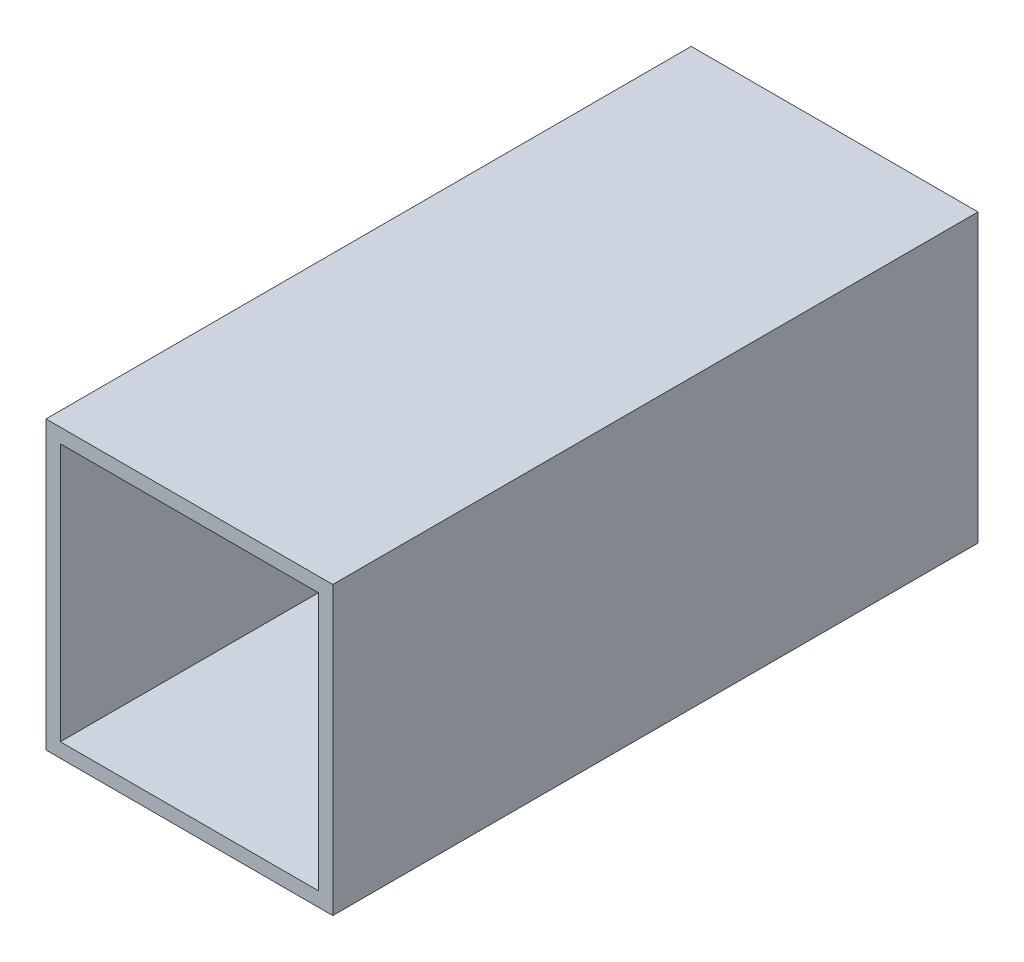
from build123d import *

# Parameters (mm, degrees)
SKETCH1_W           = 50.8
SKETCH1_H           = 50.8
SKETCH1_W_2         = 45.72
SKETCH1_H_2         = 45.72
BOSS_EXTRUDE1_DEPTH = 114.3


with BuildPart() as part:
    # Sketch1 → Boss-Extrude1 (new body)
    with BuildSketch(Plane.XY):
        with Locations((27.032857143, 25.4)):
            Rectangle(SKETCH1_W, SKETCH1_H)
        with Locations((27.032857143, 25.4)):
            Rectangle(SKETCH1_W_2, SKETCH1_H_2, mode=Mode.SUBTRACT)
    extrude(amount=BOSS_EXTRUDE1_DEPTH)


solid = part.part
